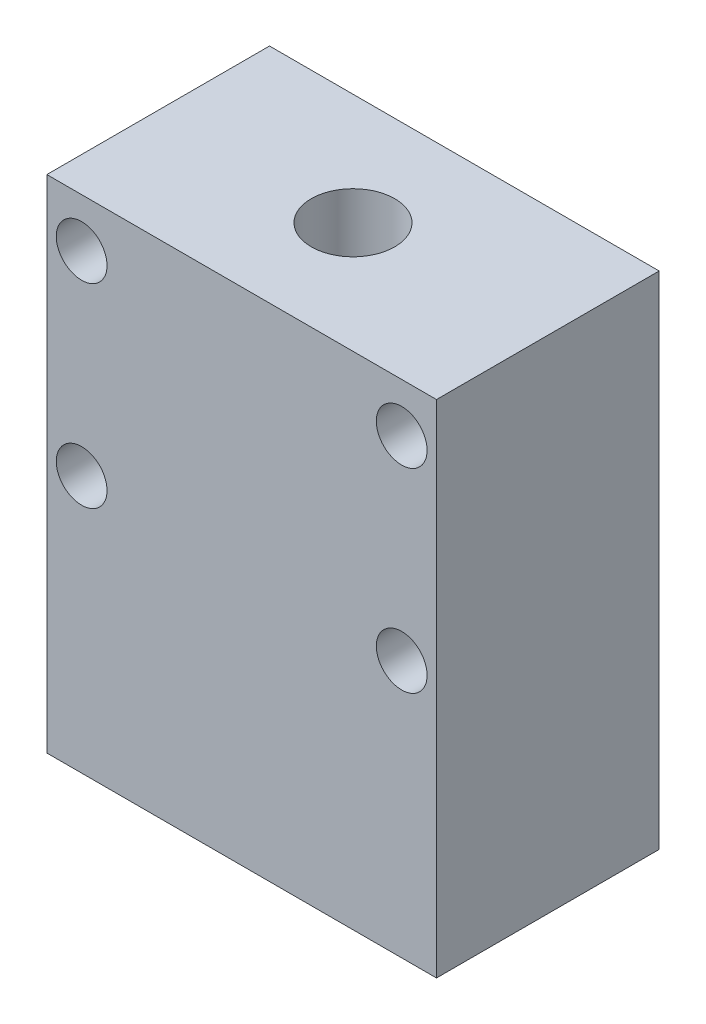
from build123d import *

# Parameters (mm, degrees)
SKETCH1_W              = 44.45
SKETCH1_H              = 25.4
BOSS_EXTRUDE1_DEPTH    = 57.15
CUT_EXTRUDE1_REACH     = 64.621
SKETCH2_R              = 4.7625
F_12_CLEARANCE_HOLE1_D = 5.7912


with BuildPart() as part:
    # Sketch1 → Boss-Extrude1 (new body)
    with BuildSketch(Plane(origin=(0, 0, 0), x_dir=(1, 0, 0), z_dir=(0, 1, 0))):
        Rectangle(SKETCH1_W, SKETCH1_H)
    extrude(amount=BOSS_EXTRUDE1_DEPTH)

    # Sketch2 → Cut-Extrude1 (cut, up to next)
    with BuildSketch(Plane(origin=(0, 57.15, 0), x_dir=(1, 0, 0), z_dir=(0, 1, 0)), mode=Mode.PRIVATE) as cut_extrude1_sk1:
        with Locations(Location((0, 0, 0), (0, 0, 270))):
            Circle(SKETCH2_R)
    cut_extrude1_tool1 = extrude(cut_extrude1_sk1.sketch, amount=-CUT_EXTRUDE1_REACH, mode=Mode.PRIVATE) & part.part
    add(cut_extrude1_tool1.solids().sort_by_distance((0, 57.15, 0))[0], mode=Mode.SUBTRACT)

    # #12 Clearance Hole1 (through all)
    with Locations(Plane.XY.offset(12.7)):
        with Locations((-18.25625, 51.5874), (18.25625, 29.3624), (-18.25625, 29.3624), (18.25625, 51.5874)):
            Hole(F_12_CLEARANCE_HOLE1_D / 2)


solid = part.part
